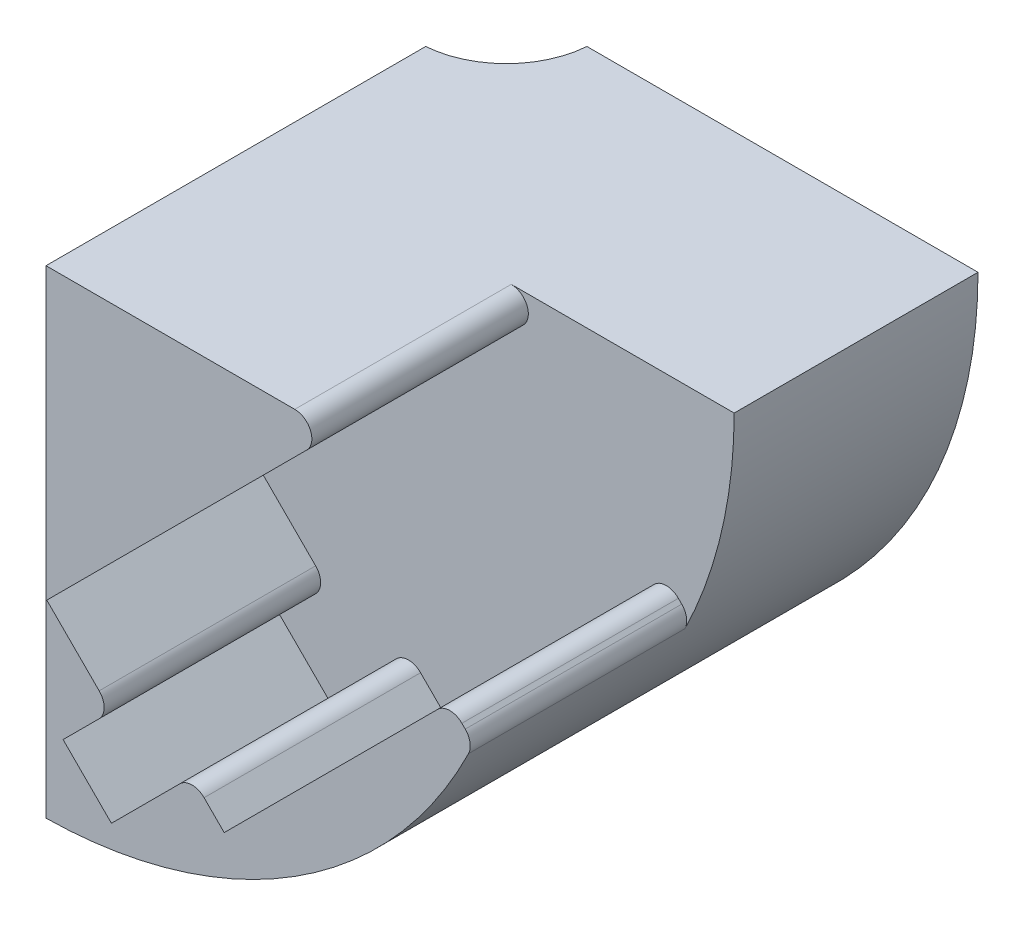
from build123d import *

# Parameters (mm, degrees)
SKETCH1_R           = 42
BOSS_EXTRUDE1_DEPTH = 41
CUT_EXTRUDE1_DEPTH  = 73.173402303
SKETCH3_R           = 7.7
CUT_EXTRUDE2_DEPTH  = 73.173402303
SKETCH4_W           = 0.6
SKETCH4_H           = 34.211954595
SKETCH4_W_2         = 35.741543893
SKETCH4_H_2         = 0.6
CUT_EXTRUDE3_DEPTH  = 73.173402476
CUT_EXTRUDE4_DEPTH  = 19
CUT_EXTRUDE6_START  = -19
CUT_EXTRUDE6_DEPTH  = 19
FILLET1_R           = 1.5


with BuildPart() as part:
    # Sketch1 → Boss-Extrude1 (new body)
    with BuildSketch(Plane.XY):
        Circle(SKETCH1_R)
    extrude(amount=BOSS_EXTRUDE1_DEPTH)

    # Sketch2 → Cut-Extrude1 (cut, through all)
    with BuildSketch(Plane.XY.offset(41)):
        with BuildLine():
            Line((0, 0), (42, 0))
            ThreePointArc((42, 0), (-29.69848481, 29.69848481), (0, -42))
            Line((0, -42), (0, 0))
        make_face()
    extrude(amount=-CUT_EXTRUDE1_DEPTH, mode=Mode.SUBTRACT)

    # Sketch3 → Cut-Extrude2 (cut, through all)
    with BuildSketch(Plane(origin=(0, 0, 0), x_dir=(1, 0, 0), z_dir=(0, 1, 0))):
        Circle(SKETCH3_R)
    extrude(amount=-CUT_EXTRUDE2_DEPTH, mode=Mode.SUBTRACT)

    # Sketch4 → Cut-Extrude3 (cut, through all)
    with BuildSketch(Plane(origin=(0, 0, 0), x_dir=(1, 0, 0), z_dir=(0, 1, 0))):
        with Locations((0.3, -23.894022702)):
            Rectangle(SKETCH4_W, SKETCH4_H)
        with Locations((24.129228054, -0.3)):
            Rectangle(SKETCH4_W_2, SKETCH4_H_2)
    extrude(amount=-CUT_EXTRUDE3_DEPTH, mode=Mode.SUBTRACT)

    # Sketch5 → Cut-Extrude4 (cut)
    with BuildSketch(Plane.XY.offset(41)):
        Polygon((36.041125497, -15.470562748), (33.212698372, -12.642135624), (13.413708499, -32.441125497), (16.242135624, -35.269552622), align=None)
        Polygon((33.919805153, -3.449747468), (31.712698372, -5.656854249), (6.256854249, -31.112698372), (2.1, -35.269552622), (6.342640687, -39.512193309), (13.413708499, -32.441125497), (33.212698372, -12.642135624), (38.162445841, -7.692388155), align=None)
    extrude(amount=-CUT_EXTRUDE4_DEPTH, mode=Mode.SUBTRACT)

    # Sketch6 → Cut-Extrude6 (cut)
    with BuildSketch(Plane.XY.offset(41).offset(CUT_EXTRUDE6_START)):
        with BuildLine():
            Line((28.970057685, -8.399494937), (6.327564928, -31.041987694))
            Line((6.327564928, -31.041987694), (0.670710678, -25.385133445))
            Line((0.670710678, -25.385133445), (26.055844123, 0))
            Line((26.055844123, 0), (42, 0))
            ThreePointArc((42, 0), (41.025156816, -8.996471987), (38.145880561, -17.575317813))
            Line((38.145880561, -17.575317813), (33.212698372, -12.642135624))
            Line((33.212698372, -12.642135624), (28.970057685, -8.399494937))
        make_face()
    extrude(amount=CUT_EXTRUDE6_DEPTH, mode=Mode.SUBTRACT)

    # Fillet1
    fillet1_edges = [part.edges().sort_by_distance(p)[0] for p in [
        (6.327564928, -31.041987694, 31.5),
        (26.055844123, 0, 31.5),
        (38.145880561, -17.575317813, 31.5),
        (36.041125497, -15.470562748, 31.5),
        (13.413708499, -32.441125497, 31.5),
    ]]
    fillet(fillet1_edges, radius=FILLET1_R)


solid = part.part
